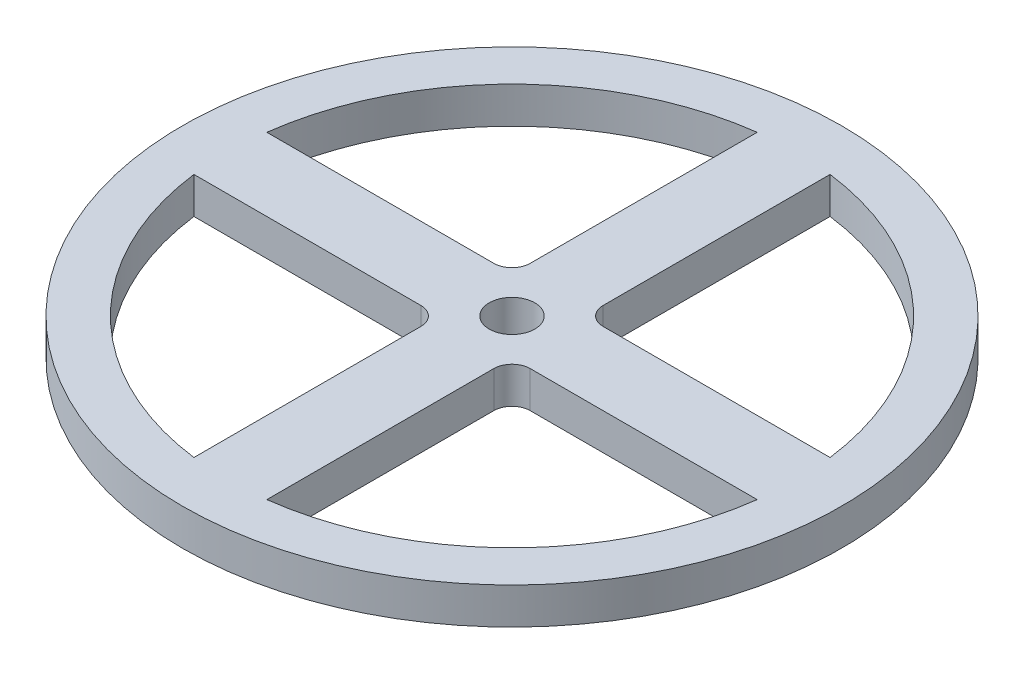
from build123d import *

# Parameters (mm, degrees)
SKETCH1_R           = 36.15
SKETCH1_R_2         = 2.5
BOSS_EXTRUDE1_DEPTH = 4


with BuildPart() as part:
    # Sketch1 → Boss-Extrude1 (new body)
    with BuildSketch(Plane(origin=(0, 0, 0), x_dir=(1, 0, 0), z_dir=(0, 1, 0))):
        with Locations(Location((0, 0, 0), (0, 0, 270))):
            Circle(SKETCH1_R)
        with Locations(Location((0, 0, 0), (0, 0, 270))):
            Circle(SKETCH1_R_2, mode=Mode.SUBTRACT)
        with BuildLine():
            ThreePointArc((4, -30.892110643), (22.026376234, -22.026376234), (30.892110643, -4))
            Line((30.892110643, -4), (6, -4))
            ThreePointArc((6, -4), (4.585786438, -4.585786438), (4, -6))
            Line((4, -6), (4, -30.892110643))
        make_face(mode=Mode.SUBTRACT)
        with BuildLine():
            ThreePointArc((30.892110643, 4), (22.026376234, 22.026376234), (4, 30.892110643))
            Line((4, 30.892110643), (4, 6))
            ThreePointArc((4, 6), (4.585786438, 4.585786438), (6, 4))
            Line((6, 4), (30.892110643, 4))
        make_face(mode=Mode.SUBTRACT)
        with BuildLine():
            ThreePointArc((-4, 30.892110643), (-22.026376234, 22.026376234), (-30.892110643, 4))
            Line((-30.892110643, 4), (-6, 4))
            ThreePointArc((-6, 4), (-4.585786438, 4.585786438), (-4, 6))
            Line((-4, 6), (-4, 30.892110643))
        make_face(mode=Mode.SUBTRACT)
        with BuildLine():
            Line((-30.892110643, -4), (-6, -4))
            ThreePointArc((-6, -4), (-4.585786438, -4.585786438), (-4, -6))
            Line((-4, -6), (-4, -30.892110643))
            ThreePointArc((-4, -30.892110643), (-22.026376234, -22.026376234), (-30.892110643, -4))
        make_face(mode=Mode.SUBTRACT)
    extrude(amount=BOSS_EXTRUDE1_DEPTH)


solid = part.part
